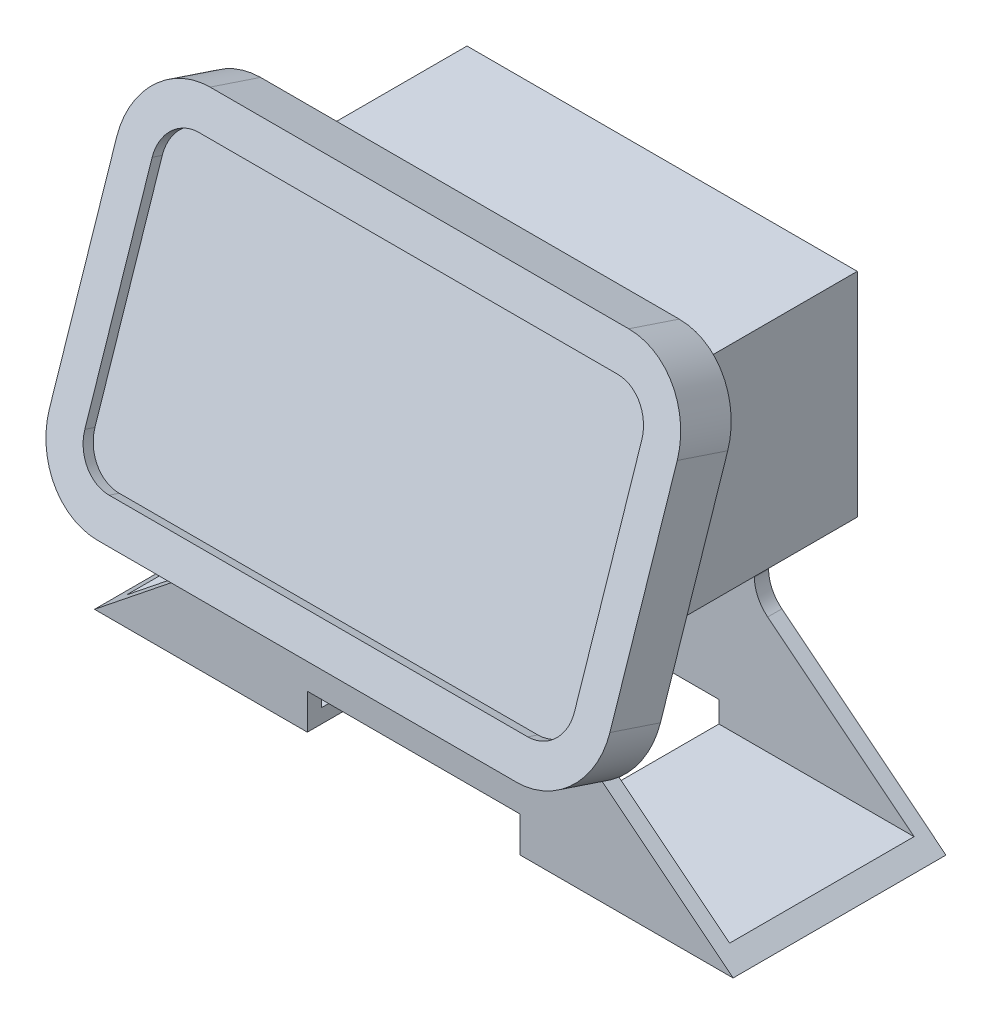
from build123d import *

# Parameters (mm, degrees)
EXTRUDE_1_DEPTH          = 30
SKETCH_2_W               = 80
SKETCH_2_H               = 60
EXTRUDE_2_DEPTH          = 20
FILLET_1_R               = 10
SKETCH_3_W               = 60
SKETCH_3_H               = 20
CUT_EXTRUDE_1_DEPTH      = 124.693168769
SKETCH_4_W               = 110
SKETCH_4_H               = 80
EXTRUDE_3_DEPTH          = 60
CUT_EXTRUDE_2_DEPTH      = 193.418814049
SKETCH_6_W               = 158
SKETCH_6_H               = 100
SKETCH_6_W_2             = 110
SKETCH_6_H_2             = 63.245553204
EXTRUDE_4_DEPTH          = 15
FILLET_2_R               = 20
CUT_EXTRUDE_3_DEPTH      = 3
CUT_EXTRUDE_4_DEPTH      = 212.765112606
CUT_EXTRUDE_4_DEPTH_BACK = 212.765112606
SKETCH_8_W               = 52
SKETCH_8_H               = 56


with BuildPart() as part:
    # 草图1 → 凸台-拉伸1 (new, symmetric)
    with BuildSketch(Plane.XY):
        Polygon((-40, 40), (-90, 0), (-30, 0), (-30, 10), (30, 10), (30, 0), (90, 0), (40, 40), align=None)
    extrude(amount=EXTRUDE_1_DEPTH, both=True)

    # 草图2 → 凸台-拉伸2 (add)
    with BuildSketch(Plane(origin=(0, 40, 0), x_dir=(1, 0, 0), z_dir=(0, 1, 0))):
        Rectangle(SKETCH_2_W, SKETCH_2_H)
    extrude(amount=EXTRUDE_2_DEPTH)

    # 圆角1
    fillet_1_edges = [part.edges().sort_by_distance(p)[0] for p in [
        (40, 40, 0),
        (-40, 40, 0),
    ]]
    fillet(fillet_1_edges, radius=FILLET_1_R)

    # 草图3 → 切除-拉伸1 (cut, through all)
    with BuildSketch(Plane.XY.offset(30)):
        with Locations((0, 50)):
            Rectangle(SKETCH_3_W, SKETCH_3_H)
    extrude(amount=-CUT_EXTRUDE_1_DEPTH, mode=Mode.SUBTRACT)

    # 草图4 → 凸台-拉伸3 (add)
    with BuildSketch(Plane(origin=(0, 60, 0), x_dir=(1, 0, 0), z_dir=(0, 1, 0))):
        Rectangle(SKETCH_4_W, SKETCH_4_H)
    extrude(amount=EXTRUDE_3_DEPTH)

    # 草图5 → 切除-拉伸2 (cut, through all)
    with BuildSketch(Plane.ZY.offset(55)):
        Polygon((20, 120), (40, 60), (40, 120), align=None)
    extrude(amount=-CUT_EXTRUDE_2_DEPTH, mode=Mode.SUBTRACT)

    # 草图6 → 凸台-拉伸4 (add)
    # profile 1 of 2: a face of its own
    with BuildSketch(Plane(origin=(0, 18, 54), x_dir=(1, 0, 0), z_dir=(0, 0.31622776601683805, 0.9486832980505138))):
        with Locations((0, 75.894663844)):
            Rectangle(SKETCH_6_W, SKETCH_6_H)
        with Locations((0, 75.894663844)):
            Rectangle(SKETCH_6_W_2, SKETCH_6_H_2, mode=Mode.SUBTRACT)
    # profile 2 of 2: a face of its own
    with BuildSketch(Plane(origin=(0, 18, 54), x_dir=(1, 0, 0), z_dir=(0, 0.31622776601683805, 0.9486832980505138))):
        with Locations((0, 75.894663844)):
            Rectangle(SKETCH_6_W_2, SKETCH_6_H_2)
    extrude(amount=EXTRUDE_4_DEPTH)

    # 圆角2
    fillet_2_edges = [part.edges().sort_by_distance(p)[0] for p in [
        (-79, 44.937543343, 52.926513036),
        (79, 44.937543343, 52.926513036),
        (79, 139.805873148, 21.303736435),
        (-79, 139.805873148, 21.303736435),
    ]]
    fillet(fillet_2_edges, radius=FILLET_2_R)

    # 草图7 → 切除-拉伸3 (cut)
    with BuildSketch(Plane(origin=(0, 22.74341649, 68.230249471), x_dir=(1, 0, 0), z_dir=(0, 0.3162277660168381, 0.9486832980505138))):
        with BuildLine():
            Line((69, 45.894663844), (69, 105.894663844))
            ThreePointArc((69, 105.894663844), (66.071067812, 112.965731656), (59, 115.894663844))
            Line((59, 115.894663844), (-59, 115.894663844))
            ThreePointArc((-59, 115.894663844), (-66.071067812, 112.965731656), (-69, 105.894663844))
            Line((-69, 105.894663844), (-69, 45.894663844))
            ThreePointArc((-69, 45.894663844), (-66.071067812, 38.823596032), (-59, 35.894663844))
            Line((-59, 35.894663844), (59, 35.894663844))
            ThreePointArc((59, 35.894663844), (66.071067812, 38.823596032), (69, 45.894663844))
        make_face()
    extrude(amount=-CUT_EXTRUDE_3_DEPTH, mode=Mode.SUBTRACT)

    # 草图8 → 切除-拉伸4 (cut, two sides: drawn at the far end of the back side and taken through both)
    with BuildSketch(Plane(origin=(55, 0, 0), x_dir=(0, 0, -1), z_dir=(1, 0, 0)).offset(-CUT_EXTRUDE_4_DEPTH_BACK)):
        with Locations((0, 32)):
            Rectangle(SKETCH_8_W, SKETCH_8_H)
    extrude(amount=CUT_EXTRUDE_4_DEPTH + CUT_EXTRUDE_4_DEPTH_BACK, mode=Mode.SUBTRACT)


solid = part.part
